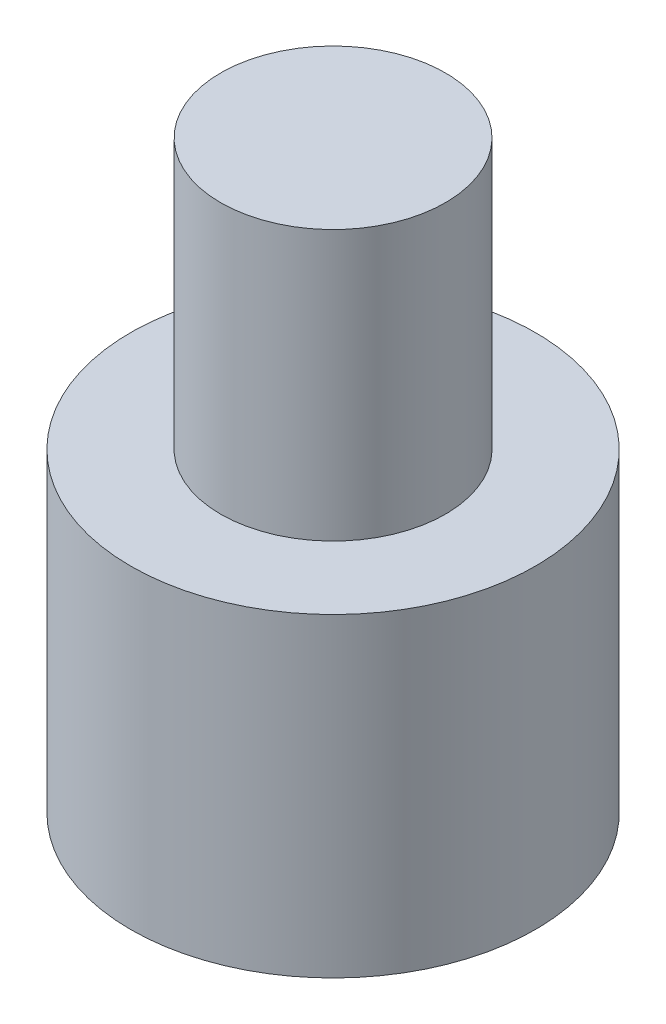
from build123d import *

# Parameters (mm, degrees)
SKETCH1_R           = 4.5
BOSS_EXTRUDE1_DEPTH = 7
SKETCH2_R           = 1.675
CUT_EXTRUDE1_DEPTH  = 6
SKETCH3_R           = 2.5
BOSS_EXTRUDE2_DEPTH = 6


with BuildPart() as part:
    # Sketch1 → Boss-Extrude1 (new body)
    with BuildSketch(Plane(origin=(0, 0, 0), x_dir=(1, 0, 0), z_dir=(0, 1, 0))):
        with Locations(Location((0, 0, 0), (0, 0, 270))):
            Circle(SKETCH1_R)
    extrude(amount=BOSS_EXTRUDE1_DEPTH)

    # Sketch2 → Cut-Extrude1 (cut)
    with BuildSketch(Plane.XZ):
        with Locations(Location((0, 0, 0), (0, 0, 270))):
            Circle(SKETCH2_R)
    extrude(amount=-CUT_EXTRUDE1_DEPTH, mode=Mode.SUBTRACT)

    # Sketch3 → Boss-Extrude2 (add)
    with BuildSketch(Plane(origin=(0, 7, 0), x_dir=(1, 0, 0), z_dir=(0, 1, 0))):
        with Locations(Location((0, 0, 0), (0, 0, 270))):
            Circle(SKETCH3_R)
    extrude(amount=BOSS_EXTRUDE2_DEPTH)


solid = part.part
